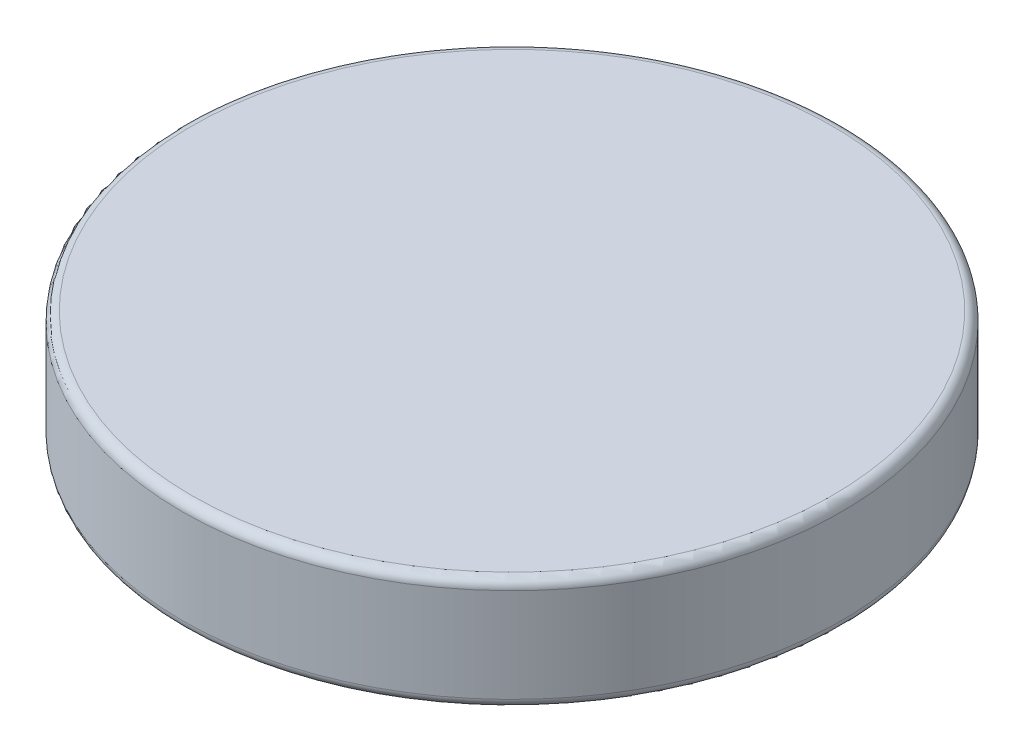
from build123d import *

# Parameters (mm, degrees)
SKETCH_1_R      = 35
EXTRUDE_1_DEPTH = 12
FILLET_1_R      = 1


with BuildPart() as part:
    # 草图1 → 凸台-拉伸1 (new body)
    with BuildSketch(Plane(origin=(0, 0, 0), x_dir=(1, 0, 0), z_dir=(0, 1, 0))):
        with Locations(Location((0, 0, 0), (0, 0, 270))):
            Circle(SKETCH_1_R)
    extrude(amount=EXTRUDE_1_DEPTH)

    # 圆角1
    fillet_1_edges = [part.edges().sort_by_distance(p)[0] for p in [
        (0, 0, -35),
        (0, 12, -35),
    ]]
    fillet(fillet_1_edges, radius=FILLET_1_R)


solid = part.part
